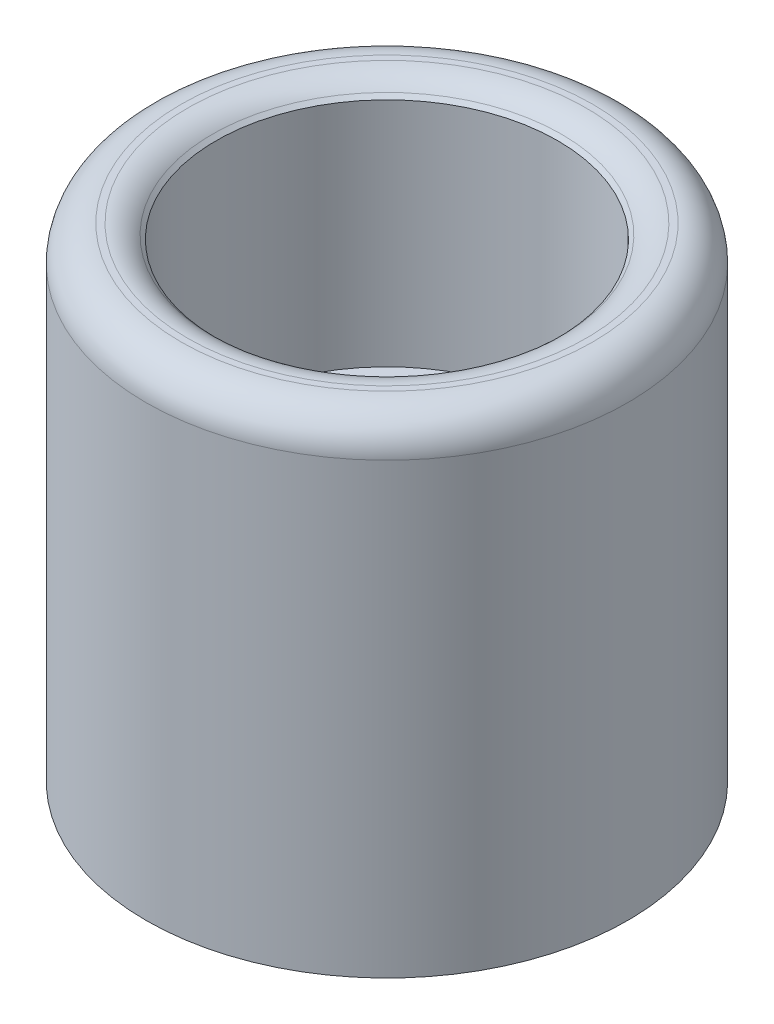
from build123d import *

# Parameters (mm, degrees)
SKETCH1_R               = 34.384
SKETCH1_R_2             = 24.384
BOSS_EXTRUDE1_DEPTH     = 35
BOSS_EXTRUDE2_START     = -34
SKETCH1_3_R             = 34.384
BOSS_EXTRUDE2_DEPTH     = 34
CHAMFER1_SIZE           = 2
FILLET2_R               = 5
CUT_EXTRUDE1_DEPTH      = 3.571875
CUT_EXTRUDE1_DEPTH_BACK = 3.571875
F_10_0MM_DOWEL_HOLE1_D  = 10


with BuildPart() as part:
    # Sketch1 → Boss-Extrude1 (new body)
    with BuildSketch(Plane(origin=(0, 0, 0), x_dir=(1, 0, 0), z_dir=(0, 1, 0))):
        Circle(SKETCH1_R)
        Circle(SKETCH1_R_2, mode=Mode.SUBTRACT)
    extrude(amount=BOSS_EXTRUDE1_DEPTH)

    # Sketch1<3> → Boss-Extrude2 (add)
    with BuildSketch(Plane(origin=(0, 0, 0), x_dir=(1, 0, 0), z_dir=(0, 1, 0)).offset(BOSS_EXTRUDE2_START)):
        Circle(SKETCH1_3_R)
    extrude(amount=BOSS_EXTRUDE2_DEPTH)

    # Chamfer1
    chamfer1_edges = [part.edges().sort_by_distance(p)[0] for p in [
        (-24.384, 35, 0),
    ]]
    chamfer(chamfer1_edges, length=CHAMFER1_SIZE)

    # Fillet2
    fillet2_edges = [part.edges().sort_by_distance(p)[0] for p in [
        (-34.384, 35, 0),
        (-26.384, 35, 0),
    ]]
    fillet(fillet2_edges, radius=FILLET2_R)

    # Sketch10 → Cut-Extrude1 (cut, two sides: drawn at the far end of the back side and taken through both)
    with BuildSketch(Plane(origin=(0, -22, 0), x_dir=(-1, 0, 0), z_dir=(0, -1, 0)).offset(-CUT_EXTRUDE1_DEPTH_BACK)):
        Polygon((7.332348419, 0), (3.666174209, 6.35), (-3.666174209, 6.35), (-7.332348419, 0), (-3.666174209, -6.35), (3.666174209, -6.35), align=None)
    extrude(amount=CUT_EXTRUDE1_DEPTH + CUT_EXTRUDE1_DEPTH_BACK, mode=Mode.SUBTRACT)

    # Ø10.0mm Dowel Hole1 (through all)
    with Locations(Plane(origin=(0, -34, 0), x_dir=(-1, 0, 0), z_dir=(0, -1, 0))):
        with Locations((0, 0)):
            Hole(F_10_0MM_DOWEL_HOLE1_D / 2)


solid = part.part
